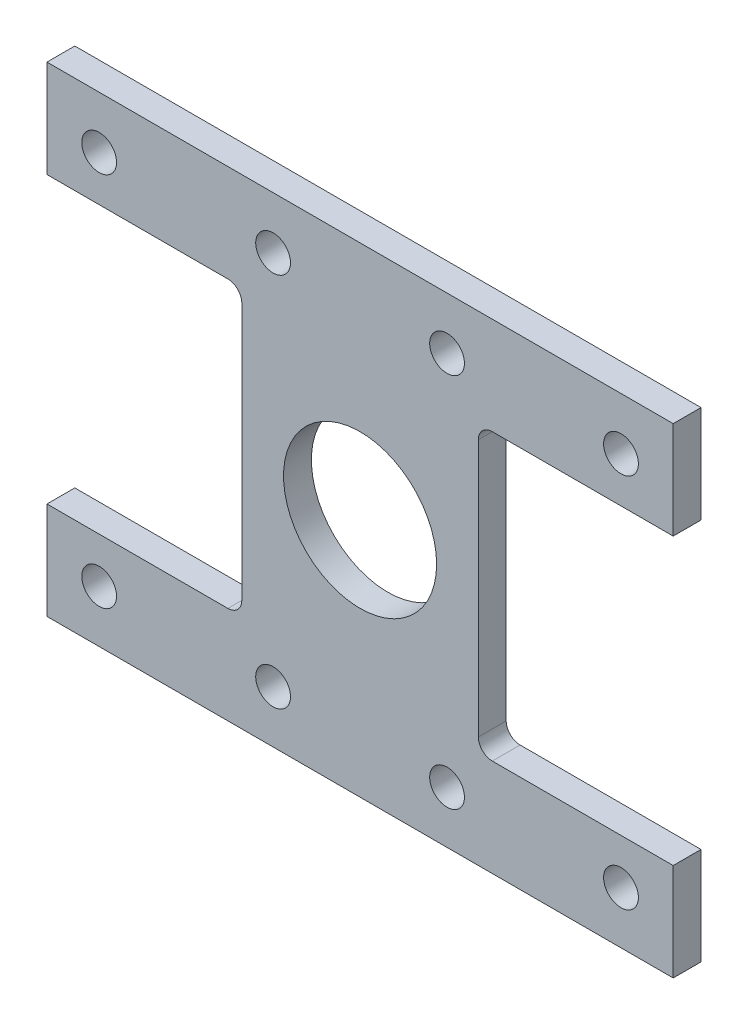
from build123d import *

# Parameters (mm, degrees)
EXTRUDE_1_DEPTH     = 4
FILLET_1_R          = 2
SKETCH_2_R          = 2.5
CUT_EXTRUDE_1_DEPTH = 83.474238402
SKETCH_3_R          = 11
CUT_EXTRUDE_2_DEPTH = 83.474238402


with BuildPart() as part:
    # 草图1 → 凸台-拉伸1 (new body)
    with BuildSketch(Plane.XY):
        Polygon((45, 0), (-45, 0), (-45, 14), (-17, 14), (-17, 55), (-45, 55), (-45, 69), (45, 69), (45, 55), (17, 55), (17, 14), (45, 14), align=None)
    extrude(amount=EXTRUDE_1_DEPTH)

    # 圆角1
    fillet_1_edges = [part.edges().sort_by_distance(p)[0] for p in [
        (-17, 14, 2),
        (-17, 55, 2),
        (17, 55, 2),
        (17, 14, 2),
    ]]
    fillet(fillet_1_edges, radius=FILLET_1_R)

    # 草图2 → 切除-拉伸1 (cut, through all)
    with BuildSketch(Plane.XY.offset(4)):
        with Locations((-37.5, 61.5)):
            Circle(SKETCH_2_R)
        with Locations(Location((37.5, 61.5, 0), (0, 0, 180))):
            Circle(SKETCH_2_R)
        with Locations((-12.5, 61.5)):
            Circle(SKETCH_2_R)
        with Locations(Location((12.5, 61.5, 0), (0, 0, 180))):
            Circle(SKETCH_2_R)
        with Locations((-37.5, 7.5)):
            Circle(SKETCH_2_R)
        with Locations(Location((37.5, 7.5, 0), (0, 0, 180))):
            Circle(SKETCH_2_R)
        with Locations((-12.5, 7.5)):
            Circle(SKETCH_2_R)
        with Locations(Location((12.5, 7.5, 0), (0, 0, 180))):
            Circle(SKETCH_2_R)
    extrude(amount=-CUT_EXTRUDE_1_DEPTH, mode=Mode.SUBTRACT)

    # 草图3 → 切除-拉伸2 (cut, through all)
    with BuildSketch(Plane.XY.offset(4)):
        with Locations((0, 34.5)):
            Circle(SKETCH_3_R)
    extrude(amount=-CUT_EXTRUDE_2_DEPTH, mode=Mode.SUBTRACT)


solid = part.part
